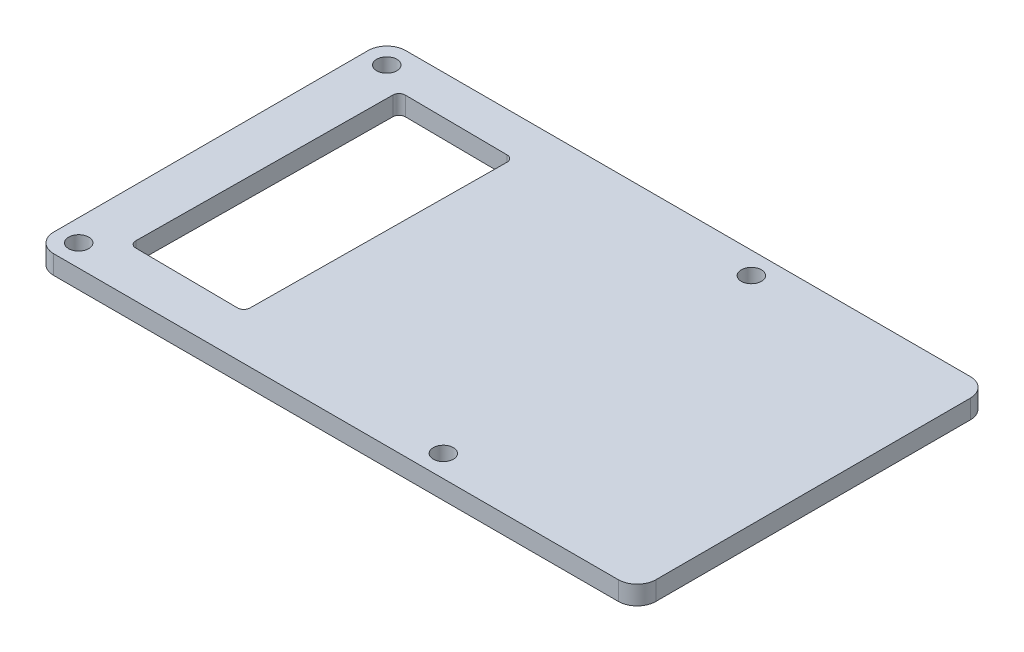
from build123d import *

# Parameters (mm, degrees)
SKETCH_1_R      = 1.6
EXTRUDE_1_DEPTH = 3


with BuildPart() as part:
    # 草图1 → 凸台-拉伸1 (new body)
    with BuildSketch(Plane(origin=(0, 0, 0), x_dir=(1, 0, 0), z_dir=(0, 1, 0))):
        with BuildLine():
            Line((-80.009028181, 21.402670377), (-80.009028181, -28.604431477))
            ThreePointArc((-80.009028181, -28.604431477), (-79.134066788, -30.716775138), (-77.021723127, -31.591736531))
            Line((-77.021723127, -31.591736531), (12.787258331, -31.591736531))
            ThreePointArc((12.787258331, -31.591736531), (14.899601993, -30.716775138), (15.774563386, -28.604431477))
            Line((15.774563386, -28.604431477), (15.774563386, 21.402670377))
            ThreePointArc((15.774563386, 21.402670377), (14.899601993, 23.515014039), (12.787258331, 24.389975432))
            Line((12.787258331, 24.389975432), (-77.021723127, 24.389975432))
            ThreePointArc((-77.021723127, 24.389975432), (-79.134066788, 23.515014039), (-80.009028181, 21.402670377))
        make_face()
        with Locations(Location((-76.52848462, 20.886724226, 0), (0, 0, 270))):
            Circle(SKETCH_1_R, mode=Mode.SUBTRACT)
        with Locations(Location((-18.52858622, 20.886597225, 0), (0, 0, 270))):
            Circle(SKETCH_1_R, mode=Mode.SUBTRACT)
        with Locations(Location((-18.52833222, -28.113656775, 0), (0, 0, 270))):
            Circle(SKETCH_1_R, mode=Mode.SUBTRACT)
        with Locations(Location((-76.52833222, -28.113529775, 0), (0, 0, 270))):
            Circle(SKETCH_1_R, mode=Mode.SUBTRACT)
        with BuildLine():
            Line((-70.903401709, 18.230282987), (-54.564490165, 18.082300473))
            ThreePointArc((-54.564490165, 18.082300473), (-53.860065027, 17.78301522), (-53.573587867, 17.073284796))
            Line((-53.573587867, 17.073284796), (-53.940568984, -23.445502526))
            ThreePointArc((-53.940568984, -23.445502526), (-54.239854236, -24.149927664), (-54.94958466, -24.436404824))
            Line((-54.94958466, -24.436404824), (-71.288496204, -24.288422311))
            ThreePointArc((-71.288496204, -24.288422311), (-71.992921342, -23.989137058), (-72.279398502, -23.279406634))
            Line((-72.279398502, -23.279406634), (-71.912417386, 17.239380688))
            ThreePointArc((-71.912417386, 17.239380688), (-71.613132133, 17.943805826), (-70.903401709, 18.230282987))
        make_face(mode=Mode.SUBTRACT)
    extrude(amount=EXTRUDE_1_DEPTH)


solid = part.part
